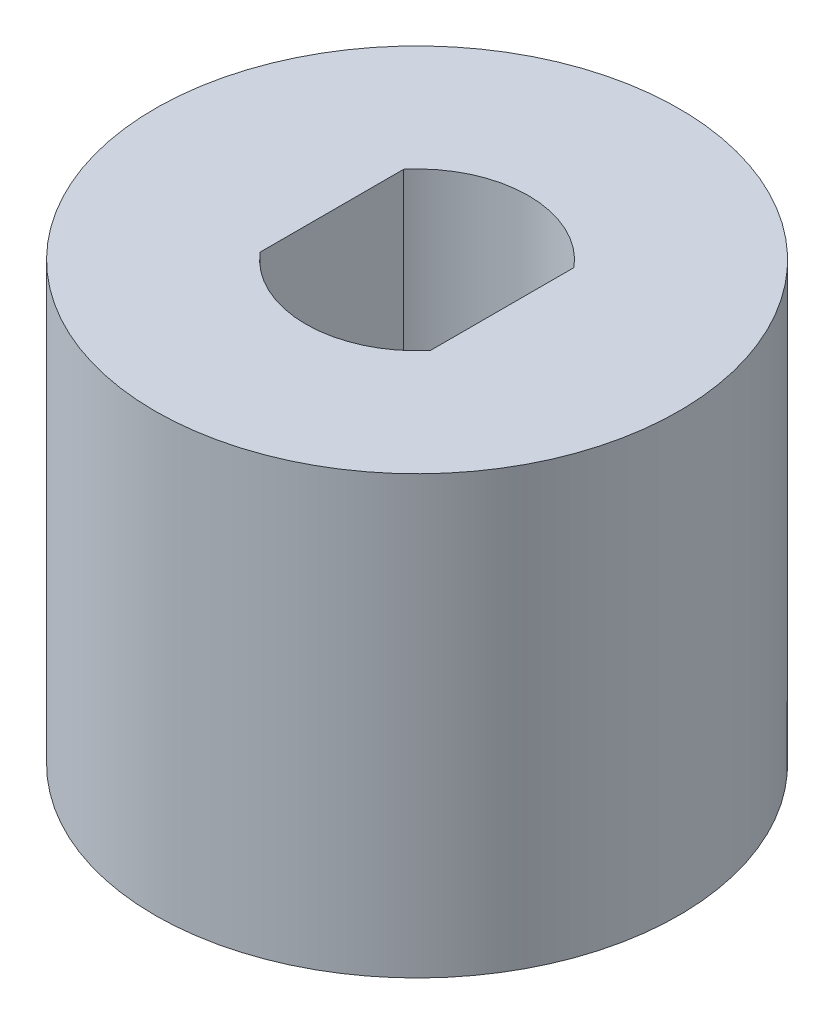
from build123d import *

# Parameters (mm, degrees)
SKETCH1_R           = 6
BOSS_EXTRUDE1_DEPTH = 10
CUT_EXTRUDE1_DEPTH  = 6
CUT_EXTRUDE2_DEPTH  = 5


with BuildPart() as part:
    # Sketch1 → Boss-Extrude1 (new body)
    with BuildSketch(Plane(origin=(0, 0, 0), x_dir=(1, 0, 0), z_dir=(0, 1, 0))):
        with Locations(Location((0, 0, 0), (0, 0, 270))):
            Circle(SKETCH1_R)
    extrude(amount=BOSS_EXTRUDE1_DEPTH)

    # Sketch3 → Cut-Extrude1 (cut)
    with BuildSketch(Plane.XZ):
        with BuildLine():
            Line((2.5, -2.485080482), (2.5, 2.485080482))
            ThreePointArc((2.5, 2.485080482), (0, 3.525), (-2.5, 2.485080482))
            Line((-2.5, 2.485080482), (-2.5, -2.485080482))
            ThreePointArc((-2.5, -2.485080482), (0, -3.525), (2.5, -2.485080482))
        make_face()
    extrude(amount=-CUT_EXTRUDE1_DEPTH, mode=Mode.SUBTRACT)

    # Sketch2 → Cut-Extrude2 (cut)
    with BuildSketch(Plane(origin=(0, 10, 0), x_dir=(1, 0, 0), z_dir=(0, 1, 0))):
        with BuildLine():
            Line((1.95, -1.643167673), (1.95, 1.643167673))
            ThreePointArc((1.95, 1.643167673), (0, 2.55), (-1.95, 1.643167673))
            Line((-1.95, 1.643167673), (-1.95, -1.643167673))
            ThreePointArc((-1.95, -1.643167673), (0, -2.55), (1.95, -1.643167673))
        make_face()
    extrude(amount=-CUT_EXTRUDE2_DEPTH, mode=Mode.SUBTRACT)


solid = part.part
